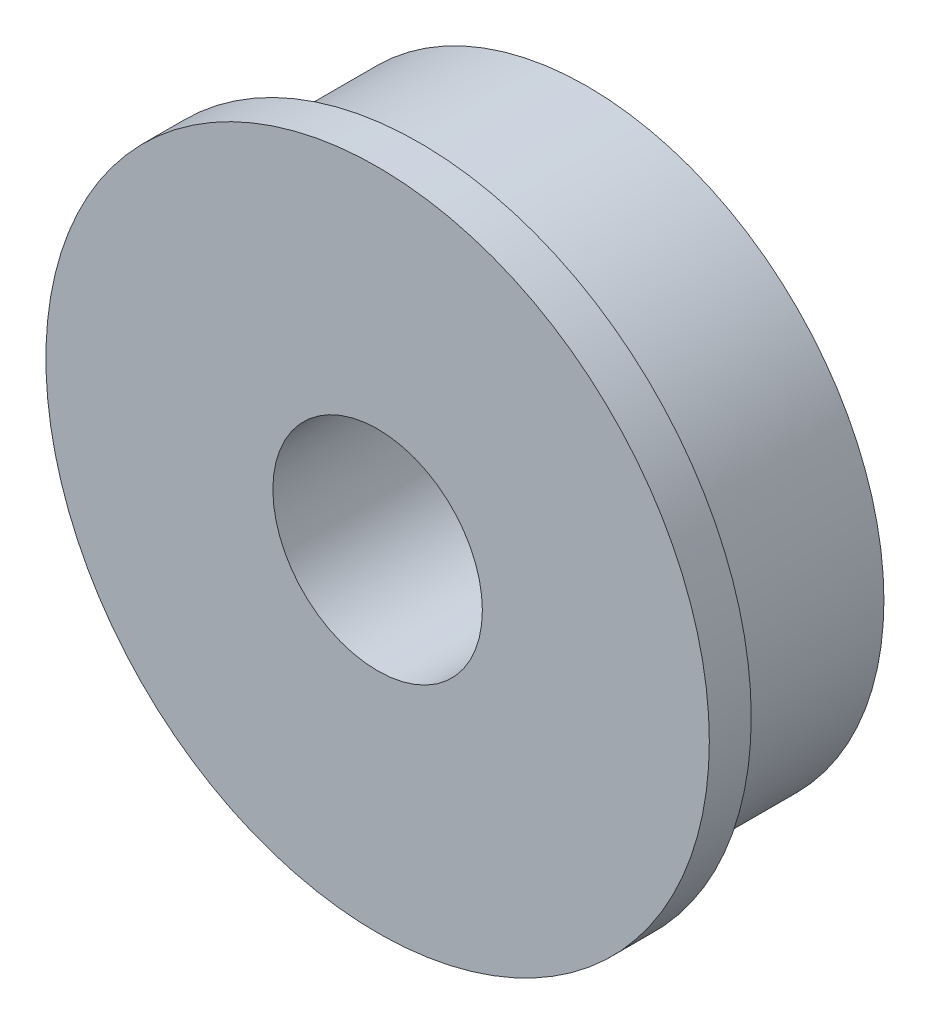
from build123d import *

# Parameters (mm, degrees)
SZKIC1_R                    = 8.5
SZKIC1_R_2                  = 3
DODANIE_WYCI_GNI_CIE1_DEPTH = 6
DODANIE_WYCI_GNI_CIE2_START = -1.2
SZKIC2_R                    = 9.5
SZKIC2_R_2                  = 8.5
DODANIE_WYCI_GNI_CIE2_DEPTH = 1.2


with BuildPart() as part:
    # Szkic1 → Dodanie-wyciągnięcie1 (new body)
    with BuildSketch(Plane.XY):
        Circle(SZKIC1_R)
        Circle(SZKIC1_R_2, mode=Mode.SUBTRACT)
    extrude(amount=DODANIE_WYCI_GNI_CIE1_DEPTH)

    # Szkic2 → Dodanie-wyciągnięcie2 (add)
    with BuildSketch(Plane.XY.offset(6).offset(DODANIE_WYCI_GNI_CIE2_START)):
        Circle(SZKIC2_R)
        Circle(SZKIC2_R_2, mode=Mode.SUBTRACT)
    extrude(amount=DODANIE_WYCI_GNI_CIE2_DEPTH)


solid = part.part
